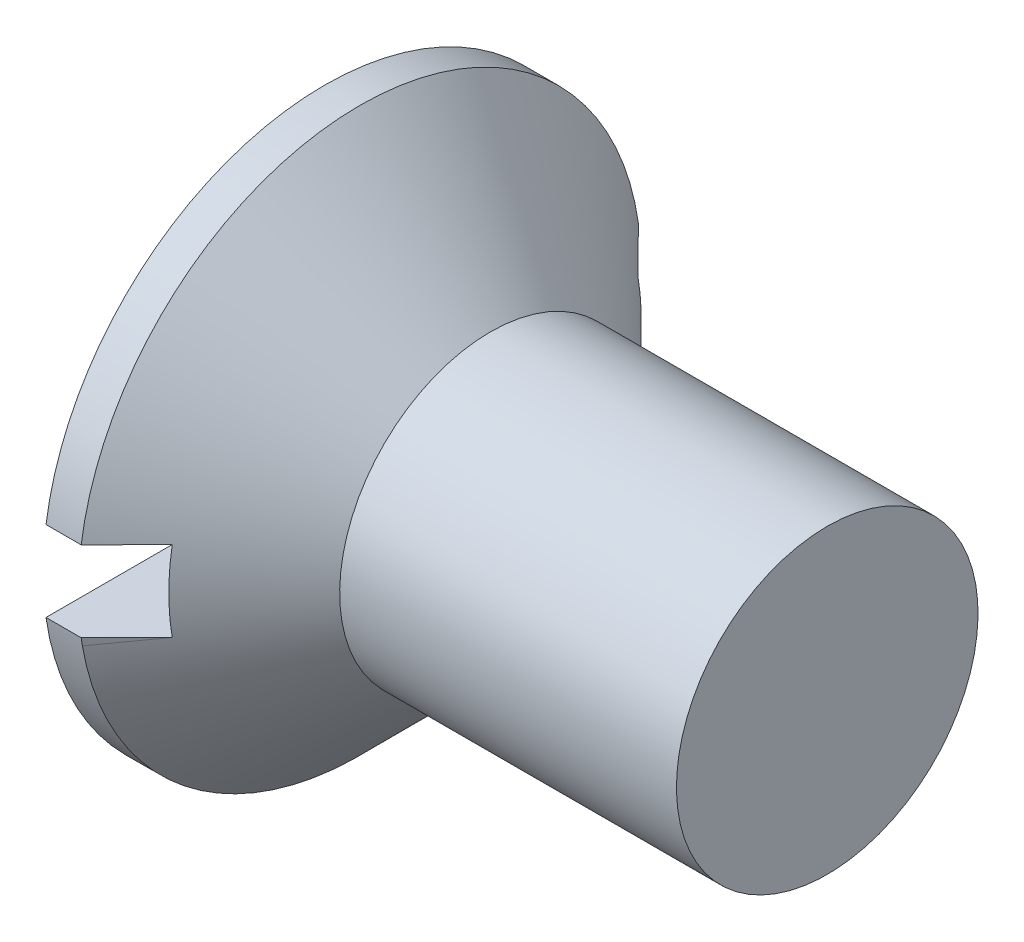
from build123d import *

# Parameters (mm, degrees)
SKETCH2_W          = 5.6
SKETCH2_H          = 0.8
CUT_EXTRUDE1_DEPTH = 0.8


with BuildPart() as part:
    # Sketch1 → Revolve1 (revolve)
    with BuildSketch(Plane.XY):
        Polygon((0, 0), (0, 2.8), (0.35, 2.8), (1.65, 1.5), (5, 1.5), (5, 0), align=None)
    revolve(axis=Axis((5, 0, 0), (-1, 0, 0)))

    # Sketch2 → Cut-Extrude1 (cut)
    with BuildSketch(Plane.ZY):
        Rectangle(SKETCH2_W, SKETCH2_H)
    extrude(amount=-CUT_EXTRUDE1_DEPTH, mode=Mode.SUBTRACT)


solid = part.part
